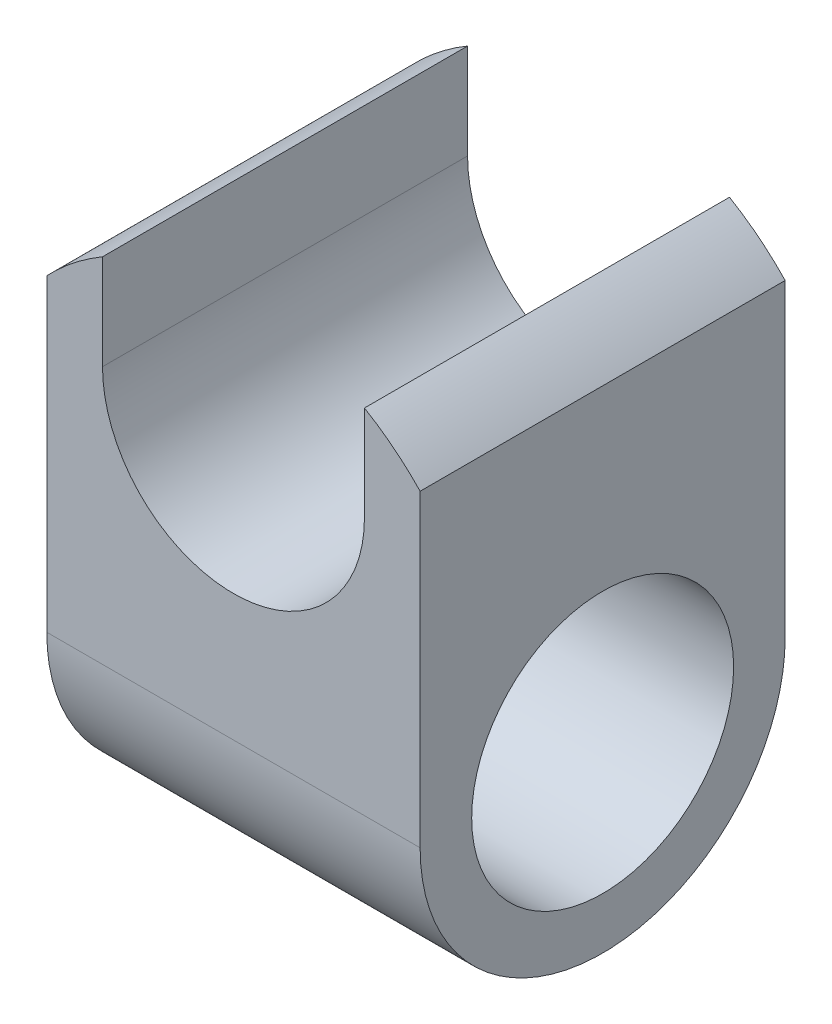
from build123d import *
from build123d.topology import SkipClean

# Parameters (mm, degrees)
BODY_SPAR_LINK_DEPTH                               = 8.85
SKETCH2_R                                          = 6.35
WING_SPAR_EXTRUDE_DEPTH                            = 9.05
SMALL_CUT_COMPLETION_REACH                         = 24.706
SKETCH3_W                                          = 0.352155439
SKETCH3_H                                          = 17.7
CUT_CLEANUP_DEPTH                                  = 30.172161479
CUT_CLEANUP_DEPTH_BACK                             = 30.172161479
SKETCH4_R                                          = 6.35
EDGE_ROUNDING_TO_FIT_END_CAP_OF_FUSELAG_DEPTH      = 30.172161479
EDGE_ROUNDING_TO_FIT_END_CAP_OF_FUSELAG_DEPTH_BACK = 30.172161479
WING_SPAR_CUT_CLEANUP_DEPTH                        = 30.355663941
WING_SPAR_CUT_CLEANUP_DEPTH_BACK                   = 30.355663941
SKETCH6_R                                          = 6.35


with BuildPart() as part:
    # Sketch1 → Body spar link (new, symmetric)
    with BuildSketch(Plane.XY):
        with BuildLine():
            Line((-6.35, 0), (-6.35, 5.93510313))
            add(Edge.make_bspline(
                [(-6.35, 5.93510313), (-7.712058184, 5.755612708), (-9.05, 5.499803523)],
                knots=[1.753235264, 1.753235264, 1.753235264, 1.832339372, 1.832339372, 1.832339372], degree=2, weights=[1, 0.999217919, 1]))
            Line((-9.05, 5.499803523), (-9.05, 0))
            ThreePointArc((-9.05, 0), (0, -9.05), (9.05, 0))
            Line((9.05, 0), (9.05, 5.499803523))
            add(Edge.make_bspline(
                [(9.05, 5.499803523), (7.712058184, 5.755612708), (6.35, 5.93510313)],
                knots=[4.450845935, 4.450845935, 4.450845935, 4.529950043, 4.529950043, 4.529950043], degree=2, weights=[1, 0.999217919, 1]))
            Line((6.35, 5.93510313), (6.35, 0))
            ThreePointArc((6.35, 0), (0, -6.35), (-6.35, 0))
        make_face()
    extrude(amount=BODY_SPAR_LINK_DEPTH, both=True)

    # Sketch2 → Wing spar extrude (add, symmetric)
    with BuildSketch(Plane(origin=(0, 0, 0), x_dir=(0, 0, -1), z_dir=(1, 0, 0))):
        with BuildLine():
            Line((-8.85, -12.5), (-8.85, -2.5))
            Line((-8.85, -2.5), (8.85, -2.5))
            Line((8.85, -2.5), (8.85, -12.5))
            ThreePointArc((8.85, -12.5), (0, -21.35), (-8.85, -12.5))
        make_face()
        with Locations((0, -12.5)):
            Circle(SKETCH2_R, mode=Mode.SUBTRACT)
    extrude(amount=WING_SPAR_EXTRUDE_DEPTH, both=True)

    # Sketch3 → Small cut completion (add, up to next)
    with BuildSketch(Plane(origin=(0, -2.5, 0), x_dir=(1, 0, 0), z_dir=(0, 1, 0)), mode=Mode.PRIVATE) as small_cut_completion_sk1:
        with Locations((8.873922281, 0)):
            Rectangle(SKETCH3_W, SKETCH3_H)
    small_cut_completion_tool1 = extrude(small_cut_completion_sk1.sketch, amount=SMALL_CUT_COMPLETION_REACH, mode=Mode.PRIVATE) - part.part
    # Sketch3 → Small cut completion (add, up to next)
    with BuildSketch(Plane(origin=(0, -2.5, 0), x_dir=(1, 0, 0), z_dir=(0, 1, 0)), mode=Mode.PRIVATE) as small_cut_completion_sk2:
        with Locations((-8.873922281, 0)):
            Rectangle(SKETCH3_W, SKETCH3_H)
    small_cut_completion_tool2 = extrude(small_cut_completion_sk2.sketch, amount=SMALL_CUT_COMPLETION_REACH, mode=Mode.PRIVATE) - part.part
    add(small_cut_completion_tool1.solids().sort_by_distance((8.873922, -2.5, 0))[0])
    add(small_cut_completion_tool2.solids().sort_by_distance((-8.873922, -2.5, 0))[0])

    # Sketch4 → Cut cleanup (cut, two sides: drawn at the far end of the back side and taken through both)
    with SkipClean():  # the faces are left unmerged after this step: merging them gives an invalid solid
        with BuildSketch(Plane(origin=(0, 0, -8.85), x_dir=(-1, 0, 0), z_dir=(0, 0, -1)).offset(-CUT_CLEANUP_DEPTH_BACK)):
            Circle(SKETCH4_R)
        extrude(amount=CUT_CLEANUP_DEPTH + CUT_CLEANUP_DEPTH_BACK, mode=Mode.SUBTRACT)

    # Sketch5 → Edge rounding (to fit end cap of fuselage) (cut, two sides: drawn at the far end of the back side and taken through both)
    with SkipClean():  # the faces are left unmerged after this step: merging them gives an invalid solid
        with BuildSketch(Plane(origin=(0, 0, -8.85), x_dir=(-1, 0, 0), z_dir=(0, 0, -1)).offset(-EDGE_ROUNDING_TO_FIT_END_CAP_OF_FUSELAG_DEPTH_BACK)):
            with BuildLine():
                Line((-12.5, -6.15), (-22.5, -6.15))
                ThreePointArc((-22.5, -6.15), (0, 16.35), (22.5, -6.15))
                Line((22.5, -6.15), (12.5, -6.15))
                ThreePointArc((12.5, -6.15), (0, 6.35), (-12.5, -6.15))
            make_face()
        extrude(amount=EDGE_ROUNDING_TO_FIT_END_CAP_OF_FUSELAG_DEPTH + EDGE_ROUNDING_TO_FIT_END_CAP_OF_FUSELAG_DEPTH_BACK, mode=Mode.SUBTRACT)

    # Sketch6 → Wing spar cut cleanup (cut, two sides: drawn at the far end of the back side and taken through both)
    with BuildSketch(Plane(origin=(9.05, 0, 0), x_dir=(0, 0, -1), z_dir=(1, 0, 0)).offset(-WING_SPAR_CUT_CLEANUP_DEPTH_BACK)):
        with Locations((0, -12.5)):
            Circle(SKETCH6_R)
    extrude(amount=WING_SPAR_CUT_CLEANUP_DEPTH + WING_SPAR_CUT_CLEANUP_DEPTH_BACK, mode=Mode.SUBTRACT)


solid = part.part
